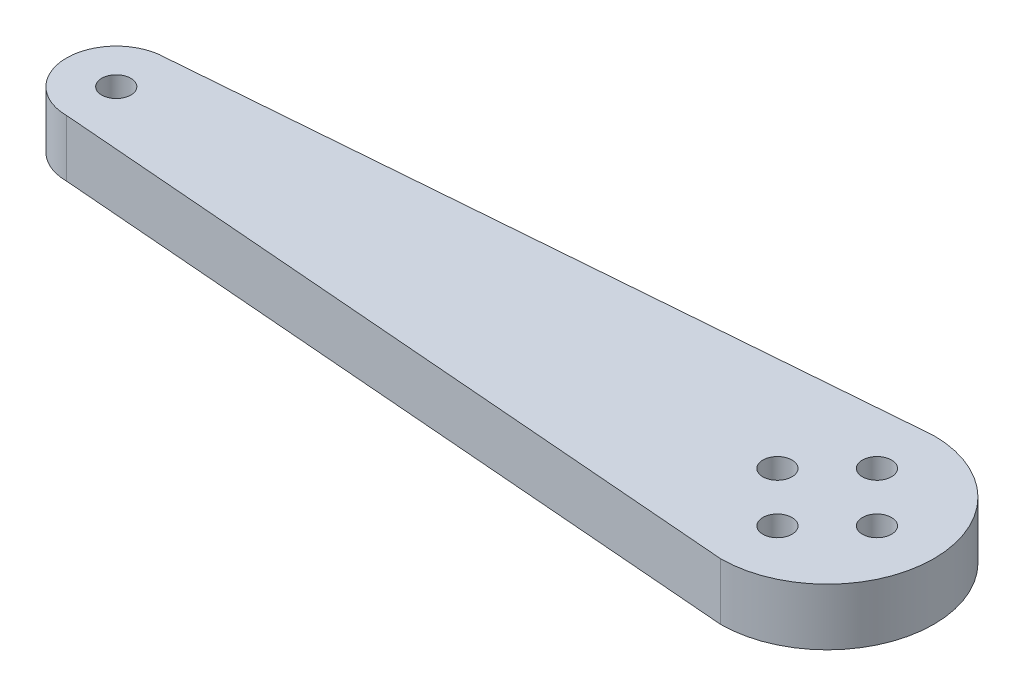
from build123d import *

# Parameters (mm, degrees)
SKETCH_1_R      = 2.05
EXTRUDE_2_DEPTH = 8


with BuildPart() as part:
    # 草图1 → 凸台-拉伸2 (new body)
    with BuildSketch(Plane(origin=(0, 0, 0), x_dir=(1, 0, 0), z_dir=(0, 1, 0))):
        with BuildLine():
            Line((100, -15), (0, -7))
            ThreePointArc((0, -7), (-7, 0), (0, 7))
            Line((0, 7), (100, 15))
            ThreePointArc((100, 15), (115, 0), (100, -15))
        make_face()
        with Locations(Location((100, 7, 0), (0, 0, 270))):
            Circle(SKETCH_1_R, mode=Mode.SUBTRACT)
        with Locations(Location((100, -7, 0), (0, 0, 270))):
            Circle(SKETCH_1_R, mode=Mode.SUBTRACT)
        with Locations(Location((93, 0, 0), (0, 0, 270))):
            Circle(SKETCH_1_R, mode=Mode.SUBTRACT)
        with Locations(Location((107, 0, 0), (0, 0, 270))):
            Circle(SKETCH_1_R, mode=Mode.SUBTRACT)
        with Locations(Location((0, 0, 0), (0, 0, 270))):
            Circle(SKETCH_1_R, mode=Mode.SUBTRACT)
    extrude(amount=EXTRUDE_2_DEPTH)


solid = part.part
